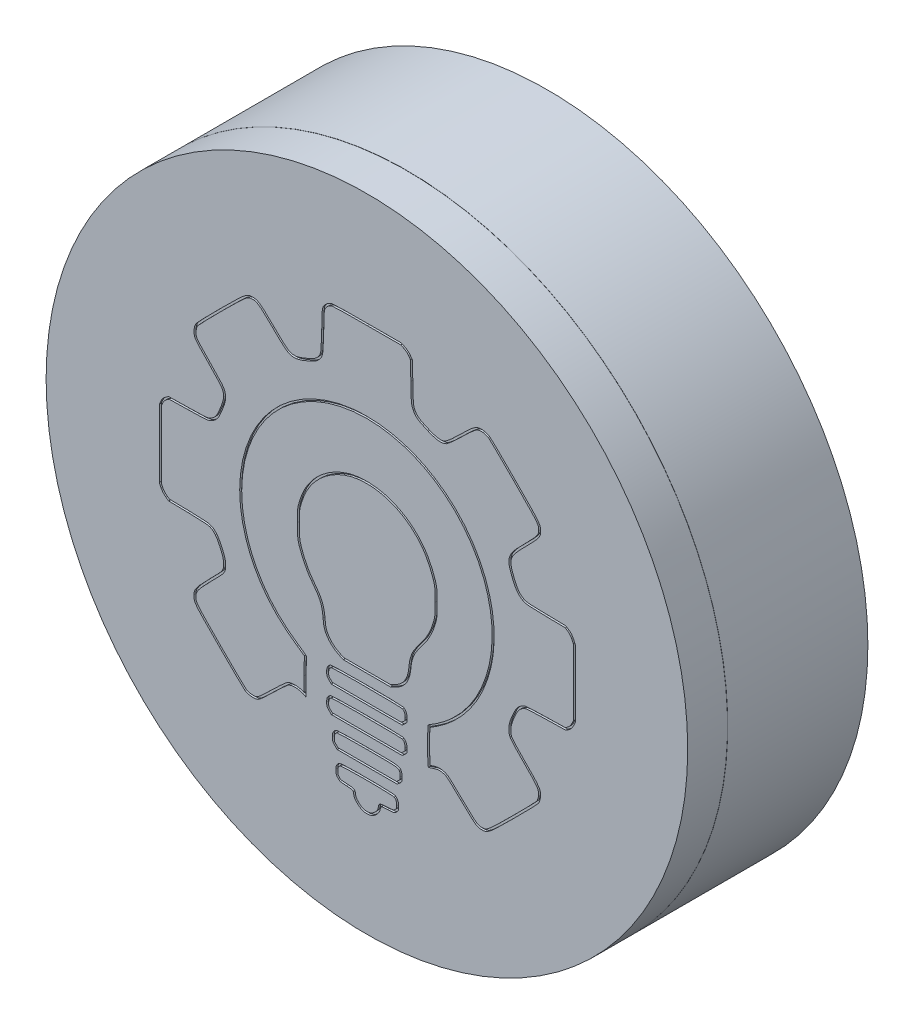
from build123d import *

# Parameters (mm, degrees)
SKETCH1_R           = 16.025
SKETCH1_R_2         = 15.025
BOSS_EXTRUDE1_DEPTH = 7
SKETCH2_R           = 16.025
BOSS_EXTRUDE3_DEPTH = 2
CUT_EXTRUDE1_DEPTH  = 0.1
SKETCH6_R           = 16.025
SKETCH6_R_2         = 16.015
CUT_EXTRUDE3_DEPTH  = 0.01


with BuildPart() as part:
    # Sketch1 → Boss-Extrude1 (new body)
    with BuildSketch(Plane.XY):
        Circle(SKETCH1_R)
        Circle(SKETCH1_R_2, mode=Mode.SUBTRACT)
    extrude(amount=BOSS_EXTRUDE1_DEPTH)

    # Sketch2 → Boss-Extrude3 (add)
    with BuildSketch(Plane.XY.offset(7)):
        Circle(SKETCH2_R)
    extrude(amount=BOSS_EXTRUDE3_DEPTH)

    # Sketch4 → Cut-Extrude1 (cut)
    # profile 1 of 6: a face of its own
    with BuildSketch(Plane.XY.offset(9)):
        with BuildLine():
            Line((-8.9288112, 2.310141401), (-9.9024785, 2.292502501))
            Line((-9.9024785, 2.292502501), (-10.0506452, 2.193724701))
            add(Edge.make_bspline(
                [(-10.0506452, 2.193724701), (-10.1529508, 2.123169101), (-10.2270342, 2.038502301), (-10.2870065, 1.911502301)],
                knots=[0, 0, 0, 0, 1, 1, 1, 1], degree=3))
            Line((-10.2870065, 1.911502301), (-10.3716732, 1.728057701))
            Line((-10.3716732, 1.728057701), (-10.3716732, 0.031195501))
            Line((-10.3716732, 0.031195501), (-10.3716732, -1.662138899))
            Line((-10.3716732, -1.662138899), (-10.2834787, -1.842055699))
            add(Edge.make_bspline(
                [(-10.2834787, -1.842055699), (-10.2270342, -1.954944599), (-10.1388397, -2.060777999), (-10.0471174, -2.120750299)],
                knots=[0, 0, 0, 0, 1, 1, 1, 1], degree=3))
            Line((-10.0471174, -2.120750299), (-9.9024785, -2.223055899))
            Line((-9.9024785, -2.223055899), (-8.9288112, -2.240694799))
            add(Edge.make_bspline(
                [(-8.9288112, -2.240694799), (-7.8281438, -2.261861499), (-7.792866, -2.268916999), (-7.5706159, -2.526444999)],
                knots=[0, 0, 0, 0, 1, 1, 1, 1], degree=3))
            add(Edge.make_bspline(
                [(-7.5706159, -2.526444999), (-7.4295047, -2.692250599), (-7.2107823, -3.172028699), (-7.1649212, -3.429556699)],
                knots=[0, 0, 0, 0, 1, 1, 1, 1], degree=3))
            add(Edge.make_bspline(
                [(-7.1649212, -3.429556699), (-7.1472823, -3.517751199), (-7.1508101, -3.651806799), (-7.168449, -3.750584599)],
                knots=[0, 0, 0, 0, 1, 1, 1, 1], degree=3))
            add(Edge.make_bspline(
                [(-7.168449, -3.750584599), (-7.2037268, -3.902279199), (-7.2566435, -3.969306999), (-7.8528383, -4.569029599)],
                knots=[0, 0, 0, 0, 1, 1, 1, 1], degree=3))
            add(Edge.make_bspline(
                [(-7.8528383, -4.569029599), (-8.5195887, -5.242835599), (-8.6395332, -5.412168999), (-8.643061, -5.659113599)],
                knots=[0, 0, 0, 0, 1, 1, 1, 1], degree=3))
            add(Edge.make_bspline(
                [(-8.643061, -5.659113599), (-8.643061, -5.980141599), (-8.6289499, -5.997780499), (-7.376588, -7.260725699)],
                knots=[0, 0, 0, 0, 1, 1, 1, 1], degree=3))
            add(Edge.make_bspline(
                [(-7.376588, -7.260725699), (-6.7239487, -7.916892799), (-6.141865, -8.484865399), (-6.0783649, -8.523670999)],
                knots=[0, 0, 0, 0, 1, 1, 1, 1], degree=3))
            add(Edge.make_bspline(
                [(-6.0783649, -8.523670999), (-5.9301982, -8.615393299), (-5.6550313, -8.647143299), (-5.4821701, -8.590698799)],
                knots=[0, 0, 0, 0, 1, 1, 1, 1], degree=3))
            add(Edge.make_bspline(
                [(-5.4821701, -8.590698799), (-5.3798645, -8.558948799), (-5.178781, -8.382559799), (-4.6919474, -7.902781699)],
                knots=[0, 0, 0, 0, 1, 1, 1, 1], degree=3))
            add(Edge.make_bspline(
                [(-4.6919474, -7.902781699), (-4.3321138, -7.550003699), (-3.9828636, -7.228975699), (-3.9158358, -7.193697899)],
                knots=[0, 0, 0, 0, 1, 1, 1, 1], degree=3))
            add(Edge.make_bspline(
                [(-3.9158358, -7.193697899), (-3.7429746, -7.101975599), (-3.414891, -7.109031199), (-3.1996965, -7.204281299)],
                knots=[0, 0, 0, 0, 1, 1, 1, 1], degree=3))
            Line((-3.1996965, -7.204281299), (-3.0338908, -7.281892399))
            Line((-3.0338908, -7.281892399), (-3.0338908, -6.399947399))
            add(Edge.make_bspline(
                [(-3.0338908, -6.399947399), (-3.0338908, -5.916641599), (-3.030363, -5.510946899), (-3.0268352, -5.493307999)],
                knots=[0, 0, 0, 0, 1, 1, 1, 1], degree=3))
            add(Edge.make_bspline(
                [(-3.0268352, -5.493307999), (-3.0268352, -5.479196799), (-3.206752, -5.345141199), (-3.4325299, -5.193446699)],
                knots=[0, 0, 0, 0, 1, 1, 1, 1], degree=3))
            add(Edge.make_bspline(
                [(-3.4325299, -5.193446699), (-4.6566696, -4.375001699), (-5.4892257, -3.288445499), (-5.9407815, -1.919666799)],
                knots=[0, 0, 0, 0, 1, 1, 1, 1], degree=3))
            add(Edge.make_bspline(
                [(-5.9407815, -1.919666799), (-6.7803932, 0.609751401), (-5.8984482, 3.431975401), (-3.7711968, 5.033587601)],
                knots=[0, 0, 0, 0, 1, 1, 1, 1], degree=3))
            add(Edge.make_bspline(
                [(-3.7711968, 5.033587601), (-1.6898066, 6.596394101), (1.1183063, 6.716338601), (3.3337521, 5.333448901)],
                knots=[0, 0, 0, 0, 1, 1, 1, 1], degree=3))
            add(Edge.make_bspline(
                [(3.3337521, 5.333448901), (5.7502814, 3.827086801), (6.8403654, 0.810834901), (5.9443093, -1.905555699)],
                knots=[0, 0, 0, 0, 1, 1, 1, 1], degree=3))
            add(Edge.make_bspline(
                [(5.9443093, -1.905555699), (5.5033368, -3.253167699), (4.649614, -4.378529499), (3.4713355, -5.168752199)],
                knots=[0, 0, 0, 0, 1, 1, 1, 1], degree=3))
            add(Edge.make_bspline(
                [(3.4713355, -5.168752199), (3.2737798, -5.299280099), (3.0973908, -5.412168999), (3.0726964, -5.419224599)],
                knots=[0, 0, 0, 0, 1, 1, 1, 1], degree=3))
            add(Edge.make_bspline(
                [(3.0726964, -5.419224599), (3.0091963, -5.440391299), (3.0127241, -7.271309099), (3.0762242, -7.260725699)],
                knots=[0, 0, 0, 0, 1, 1, 1, 1], degree=3))
            add(Edge.make_bspline(
                [(3.0762242, -7.260725699), (3.1009186, -7.257197999), (3.2173354, -7.218392399), (3.3337521, -7.179586799)],
                knots=[0, 0, 0, 0, 1, 1, 1, 1], degree=3))
            add(Edge.make_bspline(
                [(3.3337521, -7.179586799), (3.5630578, -7.094920099), (3.7711968, -7.105503399), (3.9687525, -7.204281299)],
                knots=[0, 0, 0, 0, 1, 1, 1, 1], degree=3))
            add(Edge.make_bspline(
                [(3.9687525, -7.204281299), (4.025197, -7.236031299), (4.3603361, -7.542948099), (4.7095863, -7.888670599)],
                knots=[0, 0, 0, 0, 1, 1, 1, 1], degree=3))
            add(Edge.make_bspline(
                [(4.7095863, -7.888670599), (5.3516423, -8.523670999), (5.4927535, -8.625976599), (5.7185314, -8.625976599)],
                knots=[0, 0, 0, 0, 1, 1, 1, 1], degree=3))
            add(Edge.make_bspline(
                [(5.7185314, -8.625976599), (6.0325038, -8.625976599), (6.0571983, -8.608337699), (7.3130879, -7.359503599)],
                knots=[0, 0, 0, 0, 1, 1, 1, 1], degree=3))
            add(Edge.make_bspline(
                [(7.3130879, -7.359503599), (7.969255, -6.706864299), (8.5372276, -6.124780599), (8.5760332, -6.061280499)],
                knots=[0, 0, 0, 0, 1, 1, 1, 1], degree=3))
            add(Edge.make_bspline(
                [(8.5760332, -6.061280499), (8.6148388, -6.001308299), (8.6536443, -5.870780399), (8.6677555, -5.772002599)],
                knots=[0, 0, 0, 0, 1, 1, 1, 1], degree=3))
            add(Edge.make_bspline(
                [(8.6677555, -5.772002599), (8.706561, -5.443918999), (8.6360054, -5.338085599), (7.9269217, -4.625474099)],
                knots=[0, 0, 0, 0, 1, 1, 1, 1], degree=3))
            add(Edge.make_bspline(
                [(7.9269217, -4.625474099), (7.552977, -4.251529399), (7.2707546, -3.937556999), (7.2390046, -3.867001399)],
                knots=[0, 0, 0, 0, 1, 1, 1, 1], degree=3))
            add(Edge.make_bspline(
                [(7.2390046, -3.867001399), (7.1472823, -3.648278999), (7.1719767, -3.422501099), (7.3201435, -3.052084199)],
                knots=[0, 0, 0, 0, 1, 1, 1, 1], degree=3))
            add(Edge.make_bspline(
                [(7.3201435, -3.052084199), (7.5176992, -2.565250599), (7.6235326, -2.427667099), (7.9022272, -2.304194799)],
                knots=[0, 0, 0, 0, 1, 1, 1, 1], degree=3))
            add(Edge.make_bspline(
                [(7.9022272, -2.304194799), (7.9551439, -2.279500399), (8.3643664, -2.254805899), (8.964089, -2.244222599)],
                knots=[0, 0, 0, 0, 1, 1, 1, 1], degree=3))
            Line((8.964089, -2.244222599), (9.9377563, -2.223055899))
            Line((9.9377563, -2.223055899), (10.0788675, -2.127805799))
            add(Edge.make_bspline(
                [(10.0788675, -2.127805799), (10.1705897, -2.067833599), (10.2552565, -1.969055699), (10.3152287, -1.849111199)],
                knots=[0, 0, 0, 0, 1, 1, 1, 1], degree=3))
            Line((10.3152287, -1.849111199), (10.406951, -1.662138899))
            Line((10.406951, -1.662138899), (10.406951, 0.031195501))
            Line((10.406951, 0.031195501), (10.406951, 1.728057701))
            Line((10.406951, 1.728057701), (10.3222843, 1.911502301))
            add(Edge.make_bspline(
                [(10.3222843, 1.911502301), (10.262312, 2.038502301), (10.1882286, 2.123169101), (10.085923, 2.193724701)],
                knots=[0, 0, 0, 0, 1, 1, 1, 1], degree=3))
            Line((10.085923, 2.193724701), (9.9377563, 2.292502501))
            Line((9.9377563, 2.292502501), (8.964089, 2.310141401))
            add(Edge.make_bspline(
                [(8.964089, 2.310141401), (8.0468662, 2.327780301), (7.9833661, 2.334835901), (7.8422549, 2.405391501)],
                knots=[0, 0, 0, 0, 1, 1, 1, 1], degree=3))
            add(Edge.make_bspline(
                [(7.8422549, 2.405391501), (7.6305881, 2.518280401), (7.5071158, 2.691141601), (7.3413102, 3.103891901)],
                knots=[0, 0, 0, 0, 1, 1, 1, 1], degree=3))
            add(Edge.make_bspline(
                [(7.3413102, 3.103891901), (7.0696711, 3.788281201), (7.1155323, 3.915281301), (7.9551439, 4.744309601)],
                knots=[0, 0, 0, 0, 1, 1, 1, 1], degree=3))
            add(Edge.make_bspline(
                [(7.9551439, 4.744309601), (8.5583943, 5.340504401), (8.674811, 5.499254501), (8.6783388, 5.728560201)],
                knots=[0, 0, 0, 0, 1, 1, 1, 1], degree=3))
            add(Edge.make_bspline(
                [(8.6783388, 5.728560201), (8.6783388, 6.049588201), (8.6642277, 6.067227101), (7.4118658, 7.330172301)],
                knots=[0, 0, 0, 0, 1, 1, 1, 1], degree=3))
            add(Edge.make_bspline(
                [(7.4118658, 7.330172301), (6.7592265, 7.986339401), (6.1771428, 8.554312001), (6.1136427, 8.593117601)],
                knots=[0, 0, 0, 0, 1, 1, 1, 1], degree=3))
            add(Edge.make_bspline(
                [(6.1136427, 8.593117601), (6.0536705, 8.631923201), (5.9231426, 8.670728701), (5.8243648, 8.684839901)],
                knots=[0, 0, 0, 0, 1, 1, 1, 1], degree=3))
            add(Edge.make_bspline(
                [(5.8243648, 8.684839901), (5.4962812, 8.723645401), (5.3833923, 8.653089801), (4.6743085, 7.951061601)],
                knots=[0, 0, 0, 0, 1, 1, 1, 1], degree=3))
            add(Edge.make_bspline(
                [(4.6743085, 7.951061601), (4.2862527, 7.570061401), (3.9863914, 7.301950101), (3.9052525, 7.266672301)],
                knots=[0, 0, 0, 0, 1, 1, 1, 1], degree=3))
            add(Edge.make_bspline(
                [(3.9052525, 7.266672301), (3.6900579, 7.178477801), (3.5101411, 7.199644501), (3.0903353, 7.372505701)],
                knots=[0, 0, 0, 0, 1, 1, 1, 1], degree=3))
            add(Edge.make_bspline(
                [(3.0903353, 7.372505701), (2.6281961, 7.563005801), (2.501196, 7.651200301), (2.3953626, 7.873450501)],
                knots=[0, 0, 0, 0, 1, 1, 1, 1], degree=3))
            add(Edge.make_bspline(
                [(2.3953626, 7.873450501), (2.3142237, 8.035728301), (2.3106959, 8.085117301), (2.293057, 8.998812301)],
                knots=[0, 0, 0, 0, 1, 1, 1, 1], degree=3))
            Line((2.293057, 8.998812301), (2.2754181, 9.954840701))
            Line((2.2754181, 9.954840701), (2.180168, 10.095951901))
            add(Edge.make_bspline(
                [(2.180168, 10.095951901), (2.1201958, 10.187674101), (2.0214179, 10.272340901), (1.9014734, 10.332313101)],
                knots=[0, 0, 0, 0, 1, 1, 1, 1], degree=3))
            Line((1.9014734, 10.332313101), (1.7145011, 10.424035401))
            Line((1.7145011, 10.424035401), (0.0211667, 10.420507601))
            add(Edge.make_bspline(
                [(0.0211667, 10.420507601), (-1.0830285, 10.420507601), (-1.7145011, 10.406396501), (-1.7815289, 10.381702001)],
                knots=[0, 0, 0, 0, 1, 1, 1, 1], degree=3))
            add(Edge.make_bspline(
                [(-1.7815289, 10.381702001), (-1.9438068, 10.321729801), (-2.0672791, 10.222951901), (-2.1590014, 10.078313001)],
                knots=[0, 0, 0, 0, 1, 1, 1, 1], degree=3))
            add(Edge.make_bspline(
                [(-2.1590014, 10.078313001), (-2.2366125, 9.951312901), (-2.2401403, 9.912507301), (-2.2577792, 8.995284501)],
                knots=[0, 0, 0, 0, 1, 1, 1, 1], degree=3))
            add(Edge.make_bspline(
                [(-2.2577792, 8.995284501), (-2.2789459, 7.944006101), (-2.2895292, 7.891089401), (-2.5117794, 7.668839201)],
                knots=[0, 0, 0, 0, 1, 1, 1, 1], degree=3))
            add(Edge.make_bspline(
                [(-2.5117794, 7.668839201), (-2.6564183, 7.520672501), (-3.287891, 7.249033401), (-3.5383633, 7.220811201)],
                knots=[0, 0, 0, 0, 1, 1, 1, 1], degree=3))
            add(Edge.make_bspline(
                [(-3.5383633, 7.220811201), (-3.848808, 7.189061101), (-3.9581692, 7.263144501), (-4.6425585, 7.944006101)],
                knots=[0, 0, 0, 0, 1, 1, 1, 1], degree=3))
            add(Edge.make_bspline(
                [(-4.6425585, 7.944006101), (-5.2810867, 8.579006501), (-5.4398368, 8.691895401), (-5.6797258, 8.695423201)],
                knots=[0, 0, 0, 0, 1, 1, 1, 1], degree=3))
            add(Edge.make_bspline(
                [(-5.6797258, 8.695423201), (-6.0042816, 8.695423201), (-6.0148649, 8.688367601), (-7.2778101, 7.432478001)],
                knots=[0, 0, 0, 0, 1, 1, 1, 1], degree=3))
            add(Edge.make_bspline(
                [(-7.2778101, 7.432478001), (-7.9339772, 6.776310901), (-8.5019498, 6.194227201), (-8.5407554, 6.130727101)],
                knots=[0, 0, 0, 0, 1, 1, 1, 1], degree=3))
            add(Edge.make_bspline(
                [(-8.5407554, 6.130727101), (-8.6324777, 5.982560401), (-8.6642277, 5.707393501), (-8.6077832, 5.534532301)],
                knots=[0, 0, 0, 0, 1, 1, 1, 1], degree=3))
            add(Edge.make_bspline(
                [(-8.6077832, 5.534532301), (-8.5725054, 5.432226701), (-8.3925886, 5.224087701), (-7.8986994, 4.723142901)],
                knots=[0, 0, 0, 0, 1, 1, 1, 1], degree=3))
            add(Edge.make_bspline(
                [(-7.8986994, 4.723142901), (-7.1966712, 4.010531401), (-7.1613934, 3.957614701), (-7.1613934, 3.626003301)],
                knots=[0, 0, 0, 0, 1, 1, 1, 1], degree=3))
            add(Edge.make_bspline(
                [(-7.1613934, 3.626003301), (-7.1613934, 3.435503201), (-7.4189213, 2.782863901), (-7.5565048, 2.610002701)],
                knots=[0, 0, 0, 0, 1, 1, 1, 1], degree=3))
            add(Edge.make_bspline(
                [(-7.5565048, 2.610002701), (-7.616477, 2.542974901), (-7.729366, 2.447724801), (-7.8069771, 2.405391501)],
                knots=[0, 0, 0, 0, 1, 1, 1, 1], degree=3))
            add(Edge.make_bspline(
                [(-7.8069771, 2.405391501), (-7.9480883, 2.334835901), (-8.0115884, 2.327780301), (-8.9288112, 2.310141401)],
                knots=[0, 0, 0, 0, 1, 1, 1, 1], degree=3))
        make_face()
        with BuildLine():
            Line((-8.926999902, 2.210157744), (-9.871380494, 2.193049462))
            Line((-9.871380494, 2.193049462), (-9.994499236, 2.110970301))
            add(Edge.make_bspline(
                [(-9.994499236, 2.110970301), (-10.015972402, 2.096128416), (-10.058129542, 2.063359706), (-10.109608985, 2.010305558), (-10.154972216, 1.948920007), (-10.184115388, 1.895200747), (-10.196581657, 1.868801625)],
                knots=[0.002322855, 0.002322855, 0.002322855, 0.002322855, 0.251742141, 0.501161428, 0.750580714, 1, 1, 1, 1], degree=3))
            Line((-10.196581657, 1.868801625), (-10.2716732, 1.706094025))
            Line((-10.2716732, 1.706094025), (-10.2716732, 0.031195501))
            Line((-10.2716732, 0.031195501), (-10.2716732, -1.638947353))
            Line((-10.2716732, -1.638947353), (-10.194035997, -1.797334308))
            add(Edge.make_bspline(
                [(-10.194035997, -1.797334308), (-10.18150014, -1.822406), (-10.153346231, -1.870863391), (-10.102472256, -1.939044575), (-10.045879437, -1.997625998), (-10.010525725, -2.02519697), (-9.990862899, -2.038053438)],
                knots=[0, 0, 0, 0, 0.251389654, 0.502779308, 0.754168962, 1.005558616, 1.005558616, 1.005558616, 1.005558616], degree=3))
            Line((-9.990862899, -2.038053438), (-9.869875205, -2.123630131))
            Line((-9.869875205, -2.123630131), (-8.926999941, -2.140711142))
            add(Edge.make_bspline(
                [(-8.926999941, -2.140711142), (-8.862180746, -2.141957666), (-8.726909995, -2.144608165), (-8.501448284, -2.149717566), (-8.267017407, -2.157315144), (-8.055495061, -2.171596562), (-7.840447676, -2.202019618), (-7.652009029, -2.280468647), (-7.546256444, -2.40161365), (-7.494685221, -2.461370806)],
                knots=[-3.3757e-05, -3.3757e-05, -3.3757e-05, -3.3757e-05, 0.062489449, 0.125012655, 0.250059066, 0.375105477, 0.500151889, 0.750244711, 1.000337534, 1.000337534, 1.000337534, 1.000337534], degree=3))
            add(Edge.make_bspline(
                [(-7.494685221, -2.461370806), (-7.471782984, -2.488280924), (-7.432614325, -2.542212679), (-7.345707626, -2.684567473), (-7.238650158, -2.897169549), (-7.126186895, -3.178571763), (-7.081413169, -3.328672852), (-7.066651646, -3.411008399)],
                knots=[-0.000527359, -0.000527359, -0.000527359, -0.000527359, 0.124392901, 0.249313161, 0.499153681, 0.748994201, 0.998834721, 0.998834721, 0.998834721, 0.998834721], degree=3))
            add(Edge.make_bspline(
                [(-7.066651646, -3.411008399), (-7.061005167, -3.439556125), (-7.05438461, -3.496209784), (-7.052257588, -3.589646962), (-7.057609528, -3.684324327), (-7.065267769, -3.741628224), (-7.070461535, -3.770713298)],
                knots=[0.003225677, 0.003225677, 0.003225677, 0.003225677, 0.254570237, 0.505914798, 0.757259358, 1.008603918, 1.008603918, 1.008603918, 1.008603918], degree=3))
            add(Edge.make_bspline(
                [(-7.070461535, -3.770713298), (-7.080965153, -3.815878874), (-7.106104641, -3.898585742), (-7.189632632, -4.018930581), (-7.302911509, -4.1476857), (-7.419174728, -4.271182276), (-7.548703064, -4.403992639), (-7.672683008, -4.52953956), (-7.746399011, -4.603800796), (-7.781837728, -4.639449286)],
                knots=[-0.005543247, -0.005543247, -0.005543247, -0.005543247, 0.245831167, 0.497205581, 0.622892788, 0.748579995, 0.874267202, 0.937110805, 0.999954408, 0.999954408, 0.999954408, 0.999954408], degree=3))
            add(Edge.make_bspline(
                [(-7.781837728, -4.639449286), (-7.821337599, -4.679367379), (-7.903003322, -4.762272485), (-8.04261815, -4.905889187), (-8.190355549, -5.062214834), (-8.3242641, -5.213606398), (-8.453098972, -5.377541834), (-8.529965401, -5.518028757), (-8.542300438, -5.610169362), (-8.543060974, -5.659850768)],
                knots=[4.0741e-05, 4.0741e-05, 4.0741e-05, 4.0741e-05, 0.062471231, 0.124901721, 0.249762701, 0.374623681, 0.499484661, 0.74920662, 0.99892858, 0.99892858, 0.99892858, 0.99892858], degree=3))
            add(Edge.make_bspline(
                [(-8.543060974, -5.659850768), (-8.543058616, -5.693372824), (-8.542206954, -5.767766431), (-8.529618183, -5.835035996), (-8.493945196, -5.917625312), (-8.411132744, -6.036708128), (-8.2655905, -6.206190372), (-8.045548764, -6.439835629), (-7.786403657, -6.704628735), (-7.532702631, -6.961244907), (-7.37911461, -7.116157566), (-7.305633679, -7.190259466)],
                knots=[0.000773296, 0.000773296, 0.000773296, 0.000773296, 0.125674862, 0.250576429, 0.375477995, 0.500379561, 0.625281128, 0.750182694, 0.87508426, 0.937535043, 0.999985827, 0.999985827, 0.999985827, 0.999985827], degree=3))
            add(Edge.make_bspline(
                [(-7.305633679, -7.190259466), (-7.153358611, -7.343357428), (-6.833346307, -7.66304909), (-6.503294922, -7.98785416), (-6.287950314, -8.196541318), (-6.157452131, -8.320750542), (-6.080359922, -8.392111839), (-6.036993208, -8.429696395), (-6.030525658, -8.435099243), (-6.025067512, -8.439053011)],
                knots=[2.7251e-05, 2.7251e-05, 2.7251e-05, 2.7251e-05, 0.244110931, 0.488194611, 0.610236451, 0.732278291, 0.854320131, 0.915341051, 0.976361971, 0.976361971, 0.976361971, 0.976361971], degree=3))
            add(Edge.make_bspline(
                [(-6.025067512, -8.439053011), (-5.991683575, -8.459594711), (-5.924688121, -8.487023434), (-5.777987246, -8.518332878), (-5.627062216, -8.520611861), (-5.551398416, -8.508107856), (-5.512511789, -8.495410175)],
                knots=[0.002002929, 0.002002929, 0.002002929, 0.002002929, 0.251838933, 0.501674936, 0.75151094, 1.001346943, 1.001346943, 1.001346943, 1.001346943], degree=3))
            add(Edge.make_bspline(
                [(-5.512511789, -8.495410175), (-5.503630428, -8.492653892), (-5.49204372, -8.487619639), (-5.428649131, -8.449277602), (-5.311258827, -8.355216002), (-5.126465278, -8.185462959), (-4.937693821, -8.003880128), (-4.818337078, -7.886939346), (-4.762047425, -7.831465478)],
                knots=[-0.002286545, -0.002286545, -0.002286545, -0.002286545, 0.123007203, 0.248300951, 0.498888447, 0.749475942, 0.87476969, 1.000063438, 1.000063438, 1.000063438, 1.000063438], degree=3))
            add(Edge.make_bspline(
                [(-4.762047425, -7.831465478), (-4.674457025, -7.745592547), (-4.491274922, -7.568656822), (-4.253074706, -7.346142939), (-4.098187271, -7.207928456), (-4.011645422, -7.137525983), (-3.981196982, -7.115120833), (-3.962582295, -7.10529665)],
                knots=[-8.6047e-05, -8.6047e-05, -8.6047e-05, -8.6047e-05, 0.249846695, 0.499779438, 0.749712181, 0.874678553, 0.999644924, 0.999644924, 0.999644924, 0.999644924], degree=3))
            add(Edge.make_bspline(
                [(-3.962582295, -7.10529665), (-3.905649892, -7.075110111), (-3.783711985, -7.038283863), (-3.572289683, -7.022363401), (-3.354529846, -7.045671956), (-3.221872837, -7.085107619), (-3.158257536, -7.113265234)],
                knots=[0.000188654, 0.000188654, 0.000188654, 0.000188654, 0.250514884, 0.500841113, 0.751167343, 1.001493572, 1.001493572, 1.001493572, 1.001493572], degree=3))
            Line((-3.158257536, -7.113265234), (-3.1338908, -7.124670929))
            Line((-3.1338908, -7.124670929), (-3.1338908, -6.399947399))
            add(Edge.make_bspline(
                [(-3.1338908, -6.399947399), (-3.1338908, -6.304236749), (-3.133591496, -6.104893166), (-3.132412713, -5.853413341), (-3.131022816, -5.686465295), (-3.129655456, -5.584486603), (-3.129069249, -5.552127339), (-3.128626826, -5.533621886)],
                knots=[0, 0, 0, 0, 0.206566596, 0.413133192, 0.619699788, 0.722983086, 0.826266384, 0.826266384, 0.826266384, 0.826266384], degree=3))
            add(Edge.make_bspline(
                [(-3.128626826, -5.533621886), (-3.147794136, -5.518036027), (-3.181037784, -5.492491351), (-3.267984486, -5.428646206), (-3.369180851, -5.357359427), (-3.449407195, -5.302582623), (-3.488205268, -5.27651454)],
                knots=[0.277509677, 0.277509677, 0.277509677, 0.277509677, 0.458097373, 0.638685068, 0.819272763, 0.999860458, 0.999860458, 0.999860458, 0.999860458], degree=3))
            add(Edge.make_bspline(
                [(-3.488205268, -5.27651454), (-3.790377758, -5.074479003), (-4.373472623, -4.61768117), (-5.079590788, -3.841014661), (-5.642722086, -2.960719832), (-5.923656624, -2.290755599), (-6.035718464, -1.951083056)],
                knots=[2.5476e-05, 2.5476e-05, 2.5476e-05, 2.5476e-05, 0.250013865, 0.500002254, 0.749990643, 0.999979032, 0.999979032, 0.999979032, 0.999979032], degree=3))
            add(Edge.make_bspline(
                [(-6.035718464, -1.951083056), (-6.141114012, -1.63355234), (-6.301568888, -0.976155378), (-6.406742596, 0.338049877), (-6.158565084, 1.96433807), (-5.437548547, 3.442728464), (-4.603842801, 4.463346741), (-4.098379694, 4.912425234), (-3.831292648, 5.113515652)],
                knots=[1.133e-05, 1.133e-05, 1.133e-05, 1.133e-05, 0.125010941, 0.250010551, 0.500009773, 0.750008995, 0.875008605, 1.000008216, 1.000008216, 1.000008216, 1.000008216], degree=3))
            add(Edge.make_bspline(
                [(-3.831292648, 5.113515652), (-3.570453606, 5.309365978), (-3.013866092, 5.664186454), (-1.841426533, 6.180421468), (-0.277544967, 6.482033843), (1.307709023, 6.313791097), (2.522389493, 5.898355393), (3.109162864, 5.591519146), (3.386677585, 5.418295196)],
                knots=[-8.405e-06, -8.405e-06, -8.405e-06, -8.405e-06, 0.124992167, 0.249992739, 0.499993884, 0.749995028, 0.874995601, 0.999996173, 0.999996173, 0.999996173, 0.999996173], degree=3))
            add(Edge.make_bspline(
                [(3.386677585, 5.418295196), (3.689537216, 5.229503264), (4.267420724, 4.795067968), (5.229099114, 3.772454906), (6.080963031, 2.240281635), (6.404506838, 0.515150429), (6.318402249, -0.889961918), (6.151543921, -1.596520369), (6.039313235, -1.936768941)],
                knots=[3.509e-06, 3.509e-06, 3.509e-06, 3.509e-06, 0.125001358, 0.249999208, 0.499994908, 0.749990608, 0.874988458, 0.999986308, 0.999986308, 0.999986308, 0.999986308], degree=3))
            add(Edge.make_bspline(
                [(6.039313235, -1.936768941), (5.928816048, -2.274427809), (5.650457274, -2.937051287), (5.086979503, -3.824246415), (4.384820383, -4.606557464), (3.821946552, -5.054018793), (3.526748694, -5.251995797)],
                knots=[2.7633e-05, 2.7633e-05, 2.7633e-05, 2.7633e-05, 0.250040962, 0.500054291, 0.75006762, 1.00008095, 1.00008095, 1.00008095, 1.00008095], degree=3))
            add(Edge.make_bspline(
                [(3.526748694, -5.251995797), (3.488383836, -5.277344013), (3.408869381, -5.329576632), (3.305059726, -5.396816361), (3.2142094, -5.454124321), (3.17678663, -5.476932261), (3.154763423, -5.489547854)],
                knots=[-0.000485027, -0.000485027, -0.000485027, -0.000485027, 0.199236321, 0.39895767, 0.598679018, 0.798400367, 0.798400367, 0.798400367, 0.798400367], degree=3))
            add(Edge.make_bspline(
                [(3.154763423, -5.489547854), (3.152242452, -5.506750568), (3.148932279, -5.53662281), (3.141166481, -5.634296239), (3.134010227, -5.790033643), (3.128458228, -6.019776912), (3.126297176, -6.271745262), (3.127401209, -6.528469356), (3.131803734, -6.772368853), (3.138023184, -6.948341982), (3.144787226, -7.066911196), (3.148157662, -7.110955695), (3.150388122, -7.134836326)],
                knots=[0.098871727, 0.098871727, 0.098871727, 0.098871727, 0.145400216, 0.191928704, 0.284985681, 0.378042658, 0.471099635, 0.564156612, 0.657213589, 0.750270566, 0.796799054, 0.843327543, 0.843327543, 0.843327543, 0.843327543], degree=3))
            add(Edge.make_bspline(
                [(3.150388122, -7.134836326), (3.161865191, -7.131130324), (3.184084019, -7.123887792), (3.221658781, -7.111497281), (3.260573651, -7.098569601), (3.287360116, -7.089641533), (3.300646765, -7.085212656)],
                knots=[0.53687387, 0.53687387, 0.53687387, 0.53687387, 0.651594126, 0.766314383, 0.88103464, 0.995754896, 0.995754896, 0.995754896, 0.995754896], degree=3))
            add(Edge.make_bspline(
                [(3.300646765, -7.085212656), (3.360998873, -7.063022753), (3.488502442, -7.028087087), (3.670096116, -7.016906693), (3.84749467, -7.044196716), (3.96160335, -7.088903312), (4.015654083, -7.115928693)],
                knots=[0.002040543, 0.002040543, 0.002040543, 0.002040543, 0.252450065, 0.502859588, 0.753269111, 1.003678634, 1.003678634, 1.003678634, 1.003678634], degree=3))
            add(Edge.make_bspline(
                [(4.015654083, -7.115928693), (4.031419609, -7.124796792), (4.056636489, -7.143240802), (4.136015346, -7.208927272), (4.282915591, -7.340754834), (4.513898989, -7.557432241), (4.694163701, -7.73269503), (4.779921165, -7.817586091)],
                knots=[-0.012546272, -0.012546272, -0.012546272, -0.012546272, 0.114020115, 0.240586502, 0.493719276, 0.74685205, 0.999984824, 0.999984824, 0.999984824, 0.999984824], degree=3))
            add(Edge.make_bspline(
                [(4.779921165, -7.817586091), (4.8179526, -7.85519956), (4.897000051, -7.933087247), (5.033102003, -8.065668029), (5.180195467, -8.205344878), (5.320827715, -8.330798762), (5.471039376, -8.449920884), (5.593469652, -8.516990739), (5.674951397, -8.525976599), (5.7185314, -8.525976599)],
                knots=[8.288e-06, 8.288e-06, 8.288e-06, 8.288e-06, 0.06250777, 0.125007252, 0.250006216, 0.37500518, 0.500004144, 0.750002072, 1, 1, 1, 1], degree=3))
            add(Edge.make_bspline(
                [(5.7185314, -8.525976599), (5.751337275, -8.525976599), (5.824037622, -8.5250464), (5.890315546, -8.512362873), (5.9728663, -8.476337166), (6.09207196, -8.393123137), (6.261570955, -8.247374945), (6.494927106, -8.027362034), (6.758983798, -7.76850994), (7.014623973, -7.515211986), (7.16881259, -7.361943712), (7.242572378, -7.288598302)],
                knots=[0, 0, 0, 0, 0.124999857, 0.249999714, 0.374999571, 0.499999428, 0.624999286, 0.749999143, 0.874999, 0.937498928, 0.999998857, 0.999998857, 0.999998857, 0.999998857], degree=3))
            add(Edge.make_bspline(
                [(7.242572378, -7.288598302), (7.395583599, -7.136409709), (7.715079676, -6.816594784), (8.039759547, -6.486676743), (8.24843514, -6.271352143), (8.372689822, -6.140817897), (8.444152836, -6.063626181), (8.481846416, -6.020164602), (8.487369235, -6.013552245), (8.491377405, -6.008035225)],
                knots=[2.189e-06, 2.189e-06, 2.189e-06, 2.189e-06, 0.243935921, 0.487869654, 0.60983652, 0.731803386, 0.853770253, 0.914753686, 0.975737119, 0.975737119, 0.975737119, 0.975737119], degree=3))
            add(Edge.make_bspline(
                [(8.491377405, -6.008035225), (8.499654697, -5.995243066), (8.510410303, -5.973277788), (8.53612486, -5.90413706), (8.556275893, -5.82817505), (8.565170163, -5.782684144), (8.568593327, -5.759027906)],
                knots=[-0.006009844, -0.006009844, -0.006009844, -0.006009844, 0.244357075, 0.494723995, 0.745090914, 0.995457833, 0.995457833, 0.995457833, 0.995457833], degree=3))
            add(Edge.make_bspline(
                [(8.568593327, -5.759027906), (8.572622929, -5.724765193), (8.578781696, -5.650184188), (8.570154894, -5.546017237), (8.528894726, -5.440616005), (8.412465779, -5.282729395), (8.281626003, -5.133128474), (8.130536194, -4.974346642), (7.984725843, -4.825610123), (7.897912178, -4.738091816), (7.856123969, -4.696095535)],
                knots=[0.001314798, 0.001314798, 0.001314798, 0.001314798, 0.126145306, 0.250975815, 0.500636831, 0.62546734, 0.750297848, 0.875128356, 0.93754361, 0.999958864, 0.999958864, 0.999958864, 0.999958864], degree=3))
            add(Edge.make_bspline(
                [(7.856123969, -4.696095535), (7.767301622, -4.607272012), (7.581499598, -4.417203194), (7.368813319, -4.189738437), (7.213713223, -4.007406493), (7.166662948, -3.949924687), (7.147284399, -3.906861218)],
                knots=[7.7923e-05, 7.7923e-05, 7.7923e-05, 7.7923e-05, 0.251446555, 0.502815186, 0.754183817, 1.005552449, 1.005552449, 1.005552449, 1.005552449], degree=3))
            add(Edge.make_bspline(
                [(7.147284399, -3.906861218), (7.121555618, -3.845507971), (7.084334895, -3.717358761), (7.082370374, -3.509231761), (7.12653937, -3.287732914), (7.192882296, -3.100979662), (7.22738928, -3.014712227)],
                knots=[-0.001811289, -0.001811289, -0.001811289, -0.001811289, 0.248693623, 0.499198534, 0.749703446, 1.000208358, 1.000208358, 1.000208358, 1.000208358], degree=3))
            add(Edge.make_bspline(
                [(7.22738928, -3.014712227), (7.250455933, -2.957869413), (7.300466503, -2.838499521), (7.387519065, -2.652698132), (7.49742037, -2.469751101), (7.654041328, -2.316774854), (7.79174434, -2.243798702), (7.861107562, -2.213036802)],
                knots=[-0.000158215, -0.000158215, -0.000158215, -0.000158215, 0.124774888, 0.24970799, 0.499574195, 0.7494404, 0.999306605, 0.999306605, 0.999306605, 0.999306605], degree=3))
            add(Edge.make_bspline(
                [(7.861107562, -2.213036802), (7.902929057, -2.194003088), (7.976252606, -2.188371322), (8.206825695, -2.167905757), (8.481273236, -2.156460687), (8.741343494, -2.14866856), (8.889933138, -2.145515267), (8.961916414, -2.144244028)],
                knots=[0.001884785, 0.001884785, 0.001884785, 0.001884785, 0.251356938, 0.50082909, 0.750301242, 0.875037318, 0.999773395, 0.999773395, 0.999773395, 0.999773395], degree=3))
            Line((8.961916414, -2.144244028), (9.906183732, -2.123717293))
            Line((9.906183732, -2.123717293), (10.023529234, -2.044509045))
            add(Edge.make_bspline(
                [(10.023529234, -2.044509045), (10.043031357, -2.031757659), (10.078620215, -2.004257704), (10.133384191, -1.948128839), (10.18312424, -1.881829864), (10.212777031, -1.830408064), (10.225786796, -1.804388511)],
                knots=[-0.002231974, -0.002231974, -0.002231974, -0.002231974, 0.248326019, 0.498884013, 0.749442006, 1, 1, 1, 1], degree=3))
            Line((10.225786796, -1.804388511), (10.30695183, -1.638930268))
            Line((10.30695183, -1.638930268), (10.30695183, 0.03119686))
            Line((10.30695183, 0.03119686), (10.30695183, 1.706095384))
            Line((10.30695183, 1.706095384), (10.231860816, 1.868800794))
            add(Edge.make_bspline(
                [(10.231860816, 1.868800794), (10.219394547, 1.895199916), (10.190251375, 1.948919177), (10.144888144, 2.010304727), (10.093408701, 2.063358876), (10.051251561, 2.096127586), (10.029778395, 2.110969471)],
                knots=[0, 0, 0, 0, 0.249419286, 0.498838572, 0.748257859, 0.997677145, 0.997677145, 0.997677145, 0.997677145], degree=3))
            Line((10.029778395, 2.110969471), (9.906659653, 2.193048632))
            Line((9.906659653, 2.193048632), (8.962167637, 2.210159056))
            add(Edge.make_bspline(
                [(8.962167637, 2.210159056), (8.907919362, 2.211202292), (8.794840075, 2.213422646), (8.605356263, 2.217453257), (8.40759351, 2.222495829), (8.229424598, 2.229330347), (8.052820354, 2.240693812), (7.911145017, 2.263162124), (7.83627852, 2.296576141), (7.796358235, 2.316536283)],
                knots=[0, 0, 0, 0, 0.06267372, 0.12534744, 0.25069488, 0.37604232, 0.50138976, 0.75208464, 1.00277952, 1.00277952, 1.00277952, 1.00277952], degree=3))
            add(Edge.make_bspline(
                [(7.796358235, 2.316536283), (7.738122513, 2.347595318), (7.628285546, 2.421001755), (7.491022386, 2.574477941), (7.390184343, 2.746707503), (7.311201179, 2.91483771), (7.268300671, 3.017370766), (7.248441491, 3.06680747)],
                knots=[-0.001827999, -0.001827999, -0.001827999, -0.001827999, 0.248667796, 0.499163591, 0.749659387, 0.874907284, 1.000155182, 1.000155182, 1.000155182, 1.000155182], degree=3))
            add(Edge.make_bspline(
                [(7.248441491, 3.06680747), (7.21713713, 3.145678184), (7.153321713, 3.314020055), (7.099278728, 3.516120667), (7.085655595, 3.71343309), (7.128423122, 3.905289966), (7.227417852, 4.09392417), (7.380359054, 4.293722007), (7.558712646, 4.487352456), (7.731805973, 4.663677979), (7.835045363, 4.766255545), (7.884868083, 4.815450312)],
                knots=[-9.3744e-05, -9.3744e-05, -9.3744e-05, -9.3744e-05, 0.124917163, 0.24992807, 0.374938976, 0.499949883, 0.62496079, 0.749971697, 0.874982604, 0.937488057, 0.99999351, 0.99999351, 0.99999351, 0.99999351], degree=3))
            add(Edge.make_bspline(
                [(7.884868083, 4.815450312), (7.952901966, 4.882688562), (8.098080092, 5.027524754), (8.254266145, 5.189581943), (8.377672628, 5.326255228), (8.495098473, 5.473221092), (8.565939025, 5.600533128), (8.577588918, 5.684213787), (8.578340129, 5.72935681)],
                knots=[9.054e-06, 9.054e-06, 9.054e-06, 9.054e-06, 0.12485043, 0.249691806, 0.374533181, 0.499374557, 0.749057309, 0.99874006, 0.99874006, 0.99874006, 0.99874006], degree=3))
            add(Edge.make_bspline(
                [(8.578340129, 5.72935681), (8.578337571, 5.762871314), (8.577483074, 5.837246296), (8.564889141, 5.904508479), (8.529205679, 5.987103033), (8.446382155, 6.106190957), (8.300833728, 6.275675326), (8.08079274, 6.509317649), (7.821656433, 6.774101251), (7.567967887, 7.030704702), (7.414389406, 7.185607736), (7.340912838, 7.259705237)],
                knots=[0.000836593, 0.000836593, 0.000836593, 0.000836593, 0.125730247, 0.250623901, 0.375517556, 0.50041121, 0.625304864, 0.750198518, 0.875092172, 0.937538999, 0.999985827, 0.999985827, 0.999985827, 0.999985827], degree=3))
            add(Edge.make_bspline(
                [(7.340912838, 7.259705237), (7.188729453, 7.41271102), (6.868924948, 7.732196319), (6.539020317, 8.056862634), (6.323704665, 8.265529304), (6.193175972, 8.389778524), (6.115987507, 8.4612384), (6.072527705, 8.498930362), (6.065915585, 8.504452964), (6.060398785, 8.508460976)],
                knots=[2.7251e-05, 2.7251e-05, 2.7251e-05, 2.7251e-05, 0.243954718, 0.487882185, 0.609845919, 0.731809652, 0.853773386, 0.914755252, 0.975737119, 0.975737119, 0.975737119, 0.975737119], degree=3))
            add(Edge.make_bspline(
                [(6.060398785, 8.508460976), (6.047606636, 8.516738261), (6.025641376, 8.52749386), (5.956500707, 8.553208401), (5.880538753, 8.573359429), (5.835047854, 8.582253706), (5.811391624, 8.585676874)],
                knots=[-0.006009844, -0.006009844, -0.006009844, -0.006009844, 0.244356922, 0.494723688, 0.745090454, 0.995457221, 0.995457221, 0.995457221, 0.995457221], degree=3))
            add(Edge.make_bspline(
                [(5.811391624, 8.585676874), (5.777014243, 8.589719727), (5.702394524, 8.595868235), (5.596608015, 8.587314037), (5.489376545, 8.546052244), (5.330456076, 8.430700343), (5.180420718, 8.301135923), (5.021743689, 8.151542013), (4.873434248, 8.007166753), (4.786317817, 7.921236869), (4.74451643, 7.879851417)],
                knots=[0.001315285, 0.001315285, 0.001315285, 0.001315285, 0.126159589, 0.251003894, 0.500692503, 0.625536807, 0.750381112, 0.875225416, 0.937647569, 1.000069721, 1.000069721, 1.000069721, 1.000069721], degree=3))
            add(Edge.make_bspline(
                [(4.74451643, 7.879851417), (4.653678268, 7.790664868), (4.458511788, 7.602578433), (4.232181771, 7.393653996), (4.050645247, 7.2417983), (3.988659419, 7.193893264), (3.944154342, 7.174543221)],
                knots=[-0.000127924, -0.000127924, -0.000127924, -0.000127924, 0.250901098, 0.50193012, 0.752959142, 1.003988164, 1.003988164, 1.003988164, 1.003988164], degree=3))
            add(Edge.make_bspline(
                [(3.944154342, 7.174543221), (3.885531391, 7.150517424), (3.763447117, 7.113654374), (3.567183951, 7.113439692), (3.380160801, 7.158152038), (3.206950215, 7.218019516), (3.101970845, 7.259568852), (3.052242575, 7.280045197)],
                knots=[-0.001517236, -0.001517236, -0.001517236, -0.001517236, 0.248865596, 0.499248427, 0.749631259, 0.874822675, 1.000014091, 1.000014091, 1.000014091, 1.000014091], degree=3))
            add(Edge.make_bspline(
                [(3.052242575, 7.280045197), (2.998617636, 7.302150131), (2.885618568, 7.349849782), (2.711074232, 7.430388243), (2.541205913, 7.526666834), (2.398545509, 7.659133662), (2.333151558, 7.771613818), (2.305494692, 7.829579898)],
                knots=[-1.2798e-05, -1.2798e-05, -1.2798e-05, -1.2798e-05, 0.124837068, 0.249686934, 0.499386666, 0.749086398, 0.99878613, 0.99878613, 0.99878613, 0.99878613], degree=3))
            add(Edge.make_bspline(
                [(2.305494692, 7.829579898), (2.284133301, 7.872340926), (2.246710423, 7.95416756), (2.222948641, 8.097360423), (2.211538178, 8.272431761), (2.204955239, 8.448291463), (2.200177272, 8.643645568), (2.196295658, 8.831115564), (2.194111703, 8.943213522), (2.19307398, 8.996967595)],
                knots=[0.001683746, 0.001683746, 0.001683746, 0.001683746, 0.251270602, 0.500857457, 0.625650885, 0.750444313, 0.875237741, 0.937634455, 1.000031169, 1.000031169, 1.000031169, 1.000031169], degree=3))
            Line((2.19307398, 8.996967595), (2.175980884, 9.923415403))
            Line((2.175980884, 9.923415403), (2.096872605, 10.040612804))
            add(Edge.make_bspline(
                [(2.096872605, 10.040612804), (2.084121218, 10.060114927), (2.056621263, 10.095703785), (2.000492398, 10.150467761), (1.934193423, 10.20020781), (1.882771624, 10.229860601), (1.85675207, 10.242870367)],
                knots=[-0.002231974, -0.002231974, -0.002231974, -0.002231974, 0.248326019, 0.498884013, 0.749442006, 1, 1, 1, 1], degree=3))
            Line((1.85675207, 10.242870367), (1.691392408, 10.32398704))
            Line((1.691392408, 10.32398704), (0.0211667, 10.320507601))
            add(Edge.make_bspline(
                [(0.0211667, 10.320507601), (-0.104035395, 10.320507601), (-0.364462752, 10.320104815), (-0.805128292, 10.31772463), (-1.257625847, 10.311962646), (-1.559268558, 10.302463524), (-1.685769448, 10.294618387), (-1.734982484, 10.289359044), (-1.743458931, 10.288151412), (-1.749624958, 10.286876367)],
                knots=[0, 0, 0, 0, 0.119667121, 0.239334242, 0.478668484, 0.718002726, 0.837669847, 0.897503407, 0.957336968, 0.957336968, 0.957336968, 0.957336968], degree=3))
            add(Edge.make_bspline(
                [(-1.749624958, 10.286876367), (-1.783801212, 10.274102463), (-1.851956994, 10.242844127), (-1.936654779, 10.185295413), (-2.010582647, 10.11507306), (-2.054782922, 10.055857369), (-2.074113425, 10.025447276)],
                knots=[0.006391819, 0.006391819, 0.006391819, 0.006391819, 0.254344445, 0.502297071, 0.750249697, 0.998202323, 0.998202323, 0.998202323, 0.998202323], degree=3))
            add(Edge.make_bspline(
                [(-2.074113425, 10.025447276), (-2.088062446, 10.002597137), (-2.112483798, 9.961072869), (-2.12882249, 9.870909082), (-2.139721306, 9.709890834), (-2.145983953, 9.540218992), (-2.150718372, 9.346682282), (-2.154579216, 9.159581223), (-2.156762981, 9.047166461), (-2.157798554, 8.993316631)],
                knots=[0.002001174, 0.002001174, 0.002001174, 0.002001174, 0.251504982, 0.501008791, 0.625760695, 0.750512599, 0.875264503, 0.937640455, 1.000016408, 1.000016408, 1.000016408, 1.000016408], degree=3))
            add(Edge.make_bspline(
                [(-2.157798554, 8.993316631), (-2.159045679, 8.931376183), (-2.16171986, 8.802225105), (-2.16690814, 8.586110715), (-2.174503233, 8.360379664), (-2.188048024, 8.155090401), (-2.215860125, 7.94498045), (-2.283507191, 7.759817641), (-2.387858989, 7.651349981), (-2.440676876, 7.598520412)],
                knots=[-1.4315e-05, -1.4315e-05, -1.4315e-05, -1.4315e-05, 0.062450562, 0.124915439, 0.249845193, 0.374774946, 0.4997047, 0.749564208, 0.999423716, 0.999423716, 0.999423716, 0.999423716], degree=3))
            add(Edge.make_bspline(
                [(-2.440676876, 7.598520412), (-2.467841634, 7.570797388), (-2.525546052, 7.52655493), (-2.686330191, 7.428058233), (-2.94344877, 7.304020975), (-3.215702637, 7.198481004), (-3.409852384, 7.141738294), (-3.486193889, 7.126056646), (-3.527677534, 7.121382438)],
                knots=[0.000744041, 0.000744041, 0.000744041, 0.000744041, 0.125736038, 0.250728035, 0.500712029, 0.750696022, 0.875688019, 1.000680016, 1.000680016, 1.000680016, 1.000680016], degree=3))
            add(Edge.make_bspline(
                [(-3.527677534, 7.121382438), (-3.606437063, 7.113327468), (-3.766455071, 7.108208554), (-3.959859717, 7.193721573), (-4.133552157, 7.323922268), (-4.286601259, 7.458026415), (-4.443067227, 7.606928733), (-4.587895668, 7.74883908), (-4.672441705, 7.832677938), (-4.713079625, 7.873106376)],
                knots=[-0.000549256, -0.000549256, -0.000549256, -0.000549256, 0.249587255, 0.499723766, 0.624792022, 0.749860277, 0.874928532, 0.93746266, 0.999996788, 0.999996788, 0.999996788, 0.999996788], degree=3))
            add(Edge.make_bspline(
                [(-4.713079625, 7.873106376), (-4.750897091, 7.910714886), (-4.82945004, 7.988483528), (-4.965445864, 8.121355771), (-5.113403793, 8.261857718), (-5.256575845, 8.388998008), (-5.411614162, 8.510989649), (-5.543611334, 8.582996037), (-5.632830707, 8.594672441), (-5.68048543, 8.595423187)],
                knots=[3.451e-06, 3.451e-06, 3.451e-06, 3.451e-06, 0.06243238, 0.12486131, 0.249719168, 0.374577027, 0.499434885, 0.749150602, 0.998866319, 0.998866319, 0.998866319, 0.998866319], degree=3))
            add(Edge.make_bspline(
                [(-5.68048543, 8.595423187), (-5.714481779, 8.595421945), (-5.79012312, 8.594791278), (-5.857511135, 8.582707353), (-5.939038456, 8.548123358), (-6.056940151, 8.466578291), (-6.225251094, 8.32203167), (-6.45782065, 8.1025745), (-6.721950598, 7.84340074), (-6.978238126, 7.589322271), (-7.133126654, 7.435326268), (-7.207198439, 7.361668305)],
                knots=[0.00078452, 0.00078452, 0.00078452, 0.00078452, 0.125683177, 0.250581835, 0.375480493, 0.500379151, 0.625277808, 0.750176466, 0.875075124, 0.937524453, 0.999973782, 0.999973782, 0.999973782, 0.999973782], degree=3))
            add(Edge.make_bspline(
                [(-7.207198439, 7.361668305), (-7.360239462, 7.208626951), (-7.680089387, 6.88710058), (-8.004882957, 6.556248085), (-8.213595864, 6.340531647), (-8.337816899, 6.209887266), (-8.409187504, 6.132743581), (-8.44677876, 6.089358782), (-8.452182549, 6.082889731), (-8.456137221, 6.077430022)],
                knots=[5.034e-05, 5.034e-05, 5.034e-05, 5.034e-05, 0.244130107, 0.488209874, 0.610249757, 0.732289641, 0.854329524, 0.915349466, 0.976369408, 0.976369408, 0.976369408, 0.976369408], degree=3))
            add(Edge.make_bspline(
                [(-8.456137221, 6.077430022), (-8.476595078, 6.04418244), (-8.503946466, 5.977475292), (-8.535267615, 5.831434008), (-8.537743344, 5.680980346), (-8.525581751, 5.605333051), (-8.513014042, 5.566469192)],
                knots=[0.002001996, 0.002001996, 0.002001996, 0.002001996, 0.250939209, 0.499876423, 0.748813636, 0.997750849, 0.997750849, 0.997750849, 0.997750849], degree=3))
            add(Edge.make_bspline(
                [(-8.513014042, 5.566469192), (-8.509552735, 5.556728267), (-8.503171631, 5.543567698), (-8.461310055, 5.477017687), (-8.363469299, 5.355909353), (-8.189346217, 5.166114918), (-8.003618153, 4.972792448), (-7.884177809, 4.850848954), (-7.82747536, 4.793336465)],
                knots=[0.005010377, 0.005010377, 0.005010377, 0.005010377, 0.129385232, 0.253760087, 0.502509797, 0.751259506, 0.875634361, 1.000009216, 1.000009216, 1.000009216, 1.000009216], degree=3))
            add(Edge.make_bspline(
                [(-7.82747536, 4.793336465), (-7.786044362, 4.751280881), (-7.699778356, 4.66358122), (-7.555572902, 4.515812788), (-7.406034912, 4.359101073), (-7.273826382, 4.210092479), (-7.14697602, 4.044320861), (-7.064772686, 3.862619145), (-7.0613934, 3.704029695), (-7.0613934, 3.626003301)],
                knots=[-6.481e-06, -6.481e-06, -6.481e-06, -6.481e-06, 0.062493924, 0.124994329, 0.249995139, 0.374995949, 0.499996759, 0.74999838, 1, 1, 1, 1], degree=3))
            add(Edge.make_bspline(
                [(-7.0613934, 3.626003301), (-7.0613934, 3.588579694), (-7.071739612, 3.519794466), (-7.11683165, 3.340144773), (-7.211270689, 3.07135916), (-7.325929765, 2.806679904), (-7.41731425, 2.635275534), (-7.455992119, 2.575708682), (-7.480058018, 2.545472061)],
                knots=[0, 0, 0, 0, 0.125543797, 0.251087593, 0.502175186, 0.75326278, 0.878806576, 1.004350373, 1.004350373, 1.004350373, 1.004350373], degree=3))
            add(Edge.make_bspline(
                [(-7.480058018, 2.545472061), (-7.499056458, 2.524238496), (-7.53726931, 2.485484209), (-7.610212885, 2.420917608), (-7.687272451, 2.36156016), (-7.734925655, 2.330783516), (-7.76065907, 2.316747117)],
                knots=[-0.010686216, -0.010686216, -0.010686216, -0.010686216, 0.243668044, 0.498022303, 0.752376562, 1.006730822, 1.006730822, 1.006730822, 1.006730822], degree=3))
            add(Edge.make_bspline(
                [(-7.76065907, 2.316747117), (-7.800588791, 2.296782256), (-7.875443292, 2.263265081), (-8.017098983, 2.240735828), (-8.193704725, 2.229351525), (-8.371937769, 2.222507263), (-8.569838254, 2.217459363), (-8.759492775, 2.21342476), (-8.872694894, 2.211202071), (-8.926999902, 2.210157744)],
                knots=[-0.00377166, -0.00377166, -0.00377166, -0.00377166, 0.247181378, 0.498134417, 0.623610936, 0.749087455, 0.874563974, 0.937302233, 1.000040493, 1.000040493, 1.000040493, 1.000040493], degree=3))
        make_face(mode=Mode.SUBTRACT)
    # profile 2 of 6: a face of its own
    with BuildSketch(Plane.XY.offset(9)):
        with BuildLine():
            Line((-1.4181676, -4.614890699), (-1.1818063, -4.727779699))
            Line((-1.1818063, -4.727779699), (0, -4.727779699))
            Line((0, -4.727779699), (1.1818063, -4.727779699))
            Line((1.1818063, -4.727779699), (1.4181676, -4.614890699))
            add(Edge.make_bspline(
                [(1.4181676, -4.614890699), (1.8979456, -4.389112799), (2.1413625, -4.018695899), (2.1942792, -3.433084399)],
                knots=[0, 0, 0, 0, 1, 1, 1, 1], degree=3))
            add(Edge.make_bspline(
                [(2.1942792, -3.433084399), (2.2436681, -2.896861899), (2.3495015, -2.667556199), (2.8398629, -2.046666899)],
                knots=[0, 0, 0, 0, 1, 1, 1, 1], degree=3))
            add(Edge.make_bspline(
                [(2.8398629, -2.046666899), (3.0726964, -1.750333399), (3.2773076, -1.348166499), (3.4078355, -0.917777299)],
                knots=[0, 0, 0, 0, 1, 1, 1, 1], degree=3))
            add(Edge.make_bspline(
                [(3.4078355, -0.917777299), (3.4995578, -0.617915999), (3.5066133, -0.561471499), (3.5066133, 0.052362201)],
                knots=[0, 0, 0, 0, 1, 1, 1, 1], degree=3))
            add(Edge.make_bspline(
                [(3.5066133, 0.052362201), (3.5066133, 0.662668101), (3.4995578, 0.726168201), (3.4113633, 1.015446101)],
                knots=[0, 0, 0, 0, 1, 1, 1, 1], degree=3))
            add(Edge.make_bspline(
                [(3.4113633, 1.015446101), (3.2949465, 1.392918601), (3.062113, 1.865641101), (2.8469185, 2.154919101)],
                knots=[0, 0, 0, 0, 1, 1, 1, 1], degree=3))
            add(Edge.make_bspline(
                [(2.8469185, 2.154919101), (2.084918, 3.188558601), (0.7831672, 3.724781201), (-0.5115281, 3.541336601)],
                knots=[0, 0, 0, 0, 1, 1, 1, 1], degree=3))
            add(Edge.make_bspline(
                [(-0.5115281, 3.541336601), (-1.4499176, 3.407281001), (-2.3706682, 2.818141701), (-2.9139463, 2.006752301)],
                knots=[0, 0, 0, 0, 1, 1, 1, 1], degree=3))
            add(Edge.make_bspline(
                [(-2.9139463, 2.006752301), (-3.1326686, 1.675141001), (-3.2455576, 1.435252001), (-3.3760855, 1.008390601)],
                knots=[0, 0, 0, 0, 1, 1, 1, 1], degree=3))
            add(Edge.make_bspline(
                [(-3.3760855, 1.008390601), (-3.46428, 0.726168201), (-3.4713355, 0.659140401), (-3.4713355, 0.052362201)],
                knots=[0, 0, 0, 0, 1, 1, 1, 1], degree=3))
            add(Edge.make_bspline(
                [(-3.4713355, 0.052362201), (-3.4713355, -0.561471499), (-3.46428, -0.621443799), (-3.3760855, -0.914249499)],
                knots=[0, 0, 0, 0, 1, 1, 1, 1], degree=3))
            add(Edge.make_bspline(
                [(-3.3760855, -0.914249499), (-3.2526132, -1.312888699), (-2.9809741, -1.842055699), (-2.758724, -2.117222499)],
                knots=[0, 0, 0, 0, 1, 1, 1, 1], degree=3))
            add(Edge.make_bspline(
                [(-2.758724, -2.117222499), (-2.3424459, -2.639333899), (-2.2366125, -2.879222999), (-2.1907514, -3.429556699)],
                knots=[0, 0, 0, 0, 1, 1, 1, 1], degree=3))
            add(Edge.make_bspline(
                [(-2.1907514, -3.429556699), (-2.1695847, -3.708251299), (-2.1413625, -3.831723599), (-2.0672791, -3.983418099)],
                knots=[0, 0, 0, 0, 1, 1, 1, 1], degree=3))
            add(Edge.make_bspline(
                [(-2.0672791, -3.983418099), (-1.9332234, -4.255057199), (-1.70039, -4.480835099), (-1.4181676, -4.614890699)],
                knots=[0, 0, 0, 0, 1, 1, 1, 1], degree=3))
        make_face()
        with BuildLine():
            Line((-1.375165769, -4.52460862), (-1.159151361, -4.627779699))
            Line((-1.159151361, -4.627779699), (0, -4.627779699))
            Line((0, -4.627779699), (1.159151361, -4.627779699))
            Line((1.159151361, -4.627779699), (1.375328448, -4.524530923))
            add(Edge.make_bspline(
                [(1.375328448, -4.524530923), (1.480217927, -4.475171164), (1.688225532, -4.3470237), (1.893338048, -4.115599075), (2.010912473, -3.8652306), (2.069850946, -3.629006668), (2.088635332, -3.491034319), (2.094692758, -3.423998803)],
                knots=[-0.000180254, -0.000180254, -0.000180254, -0.000180254, 0.249877064, 0.499934383, 0.749991701, 0.87502036, 1.000049019, 1.000049019, 1.000049019, 1.000049019], degree=3))
            add(Edge.make_bspline(
                [(2.094692758, -3.423998803), (2.100643045, -3.359395671), (2.11561062, -3.226046023), (2.157642401, -2.996305306), (2.246570769, -2.731010343), (2.407648401, -2.458288363), (2.585840983, -2.209948503), (2.704451337, -2.056779175), (2.761307495, -1.984787466)],
                knots=[-5.3526e-05, -5.3526e-05, -5.3526e-05, -5.3526e-05, 0.124946532, 0.249946591, 0.499946708, 0.749946825, 0.874946883, 0.999946941, 0.999946941, 0.999946941, 0.999946941], degree=3))
            add(Edge.make_bspline(
                [(2.761307495, -1.984787466), (2.819673464, -1.910495407), (2.9248575, -1.759605555), (3.076375693, -1.491062846), (3.20759939, -1.200121777), (3.28057938, -0.99281839), (3.312174236, -0.888640781)],
                knots=[0.000114103, 0.000114103, 0.000114103, 0.000114103, 0.250107651, 0.500101199, 0.750094747, 1.000088295, 1.000088295, 1.000088295, 1.000088295], degree=3))
            add(Edge.make_bspline(
                [(3.312174236, -0.888640781), (3.322432115, -0.855105413), (3.344037416, -0.783463701), (3.372781971, -0.675011769), (3.39468612, -0.551769607), (3.403873434, -0.370869502), (3.406392339, -0.163710706), (3.4066133, -0.015983288), (3.4066133, 0.052362201)],
                knots=[-0.000126638, -0.000126638, -0.000126638, -0.000126638, 0.124889192, 0.249905022, 0.499936681, 0.749968341, 0.87498417, 1, 1, 1, 1], degree=3))
            add(Edge.make_bspline(
                [(3.4066133, 0.052362201), (3.4066133, 0.120398345), (3.406392336, 0.26731841), (3.4039308, 0.474371949), (3.395006351, 0.656084404), (3.373853429, 0.778913422), (3.346280592, 0.884771039), (3.325625096, 0.953760541), (3.315757466, 0.986127996)],
                knots=[0, 0, 0, 0, 0.124977402, 0.249954803, 0.499909607, 0.74986441, 0.874841811, 0.999819213, 0.999819213, 0.999819213, 0.999819213], degree=3))
            add(Edge.make_bspline(
                [(3.315757466, 0.986127996), (3.285634662, 1.083778381), (3.217583118, 1.269835579), (3.079874884, 1.576792782), (2.921586839, 1.867763256), (2.823314156, 2.019107225), (2.766555122, 2.095406293)],
                knots=[0.000140302, 0.000140302, 0.000140302, 0.000140302, 0.250155238, 0.500170173, 0.750185108, 1.000200043, 1.000200043, 1.000200043, 1.000200043], degree=3))
            add(Edge.make_bspline(
                [(2.766555122, 2.095406293), (2.584221522, 2.342738428), (2.145366036, 2.789291714), (1.345344224, 3.248464981), (0.449887285, 3.489105081), (-0.188171968, 3.486148756), (-0.497442535, 3.442333569)],
                knots=[-5.6164e-05, -5.6164e-05, -5.6164e-05, -5.6164e-05, 0.24995412, 0.499964404, 0.749974688, 0.999984972, 0.999984972, 0.999984972, 0.999984972], degree=3))
            add(Edge.make_bspline(
                [(-0.497442535, 3.442333569), (-0.727096101, 3.40952127), (-1.175401595, 3.290128386), (-1.819157552, 2.964601234), (-2.389561738, 2.51462582), (-2.698233516, 2.149136514), (-2.830660517, 1.951402493)],
                knots=[2.0792e-05, 2.0792e-05, 2.0792e-05, 2.0792e-05, 0.249985204, 0.499949616, 0.749914028, 0.999878439, 0.999878439, 0.999878439, 0.999878439], degree=3))
            add(Edge.make_bspline(
                [(-2.830660517, 1.951402493), (-2.880407575, 1.875970239), (-2.979993896, 1.716679601), (-3.089962809, 1.503457563), (-3.185159892, 1.275105481), (-3.251354828, 1.074318913), (-3.280546095, 0.978855604)],
                knots=[0.000296618, 0.000296618, 0.000296618, 0.000296618, 0.250279675, 0.500262732, 0.75024579, 1.000228847, 1.000228847, 1.000228847, 1.000228847], degree=3))
            add(Edge.make_bspline(
                [(-3.280546095, 0.978855604), (-3.290425898, 0.947240234), (-3.31104955, 0.879901924), (-3.338564276, 0.775988091), (-3.359707171, 0.654190001), (-3.368650524, 0.472736714), (-3.371114138, 0.266275461), (-3.3713355, 0.120086984), (-3.3713355, 0.052362201)],
                knots=[-0.000345476, -0.000345476, -0.000345476, -0.000345476, 0.124697709, 0.249740893, 0.499827262, 0.749913631, 0.874956816, 1, 1, 1, 1], degree=3))
            add(Edge.make_bspline(
                [(-3.3713355, 0.052362201), (-3.3713355, -0.015999395), (-3.371114703, -0.163692906), (-3.36865424, -0.371312996), (-3.359737736, -0.553022951), (-3.338592127, -0.675899409), (-3.310995577, -0.782481871), (-3.290306077, -0.852300295), (-3.280448096, -0.885032334)],
                knots=[0, 0, 0, 0, 0.12494599, 0.24989198, 0.49978396, 0.749675939, 0.874621929, 0.999567919, 0.999567919, 0.999567919, 0.999567919], degree=3))
            add(Edge.make_bspline(
                [(-3.280448096, -0.885032334), (-3.2480176, -0.989677801), (-3.173996635, -1.186630368), (-3.017696204, -1.522053538), (-2.875351814, -1.775161794), (-2.760035318, -1.950837842), (-2.709103402, -2.019507286), (-2.680731235, -2.054634733)],
                knots=[0.000321659, 0.000321659, 0.000321659, 0.000321659, 0.250315728, 0.500309796, 0.750303864, 0.875300898, 1.000297932, 1.000297932, 1.000297932, 1.000297932], degree=3))
            add(Edge.make_bspline(
                [(-2.680731235, -2.054634733), (-2.631746267, -2.116073493), (-2.530734745, -2.246123313), (-2.375199072, -2.466239386), (-2.231690449, -2.721313504), (-2.150149615, -2.984952357), (-2.110706615, -3.218461821), (-2.096580946, -3.355442625), (-2.091066357, -3.421617755)],
                knots=[-0.000157817, -0.000157817, -0.000157817, -0.000157817, 0.12488959, 0.249936997, 0.500031811, 0.750126625, 0.875174032, 1.000221439, 1.000221439, 1.000221439, 1.000221439], degree=3))
            add(Edge.make_bspline(
                [(-2.091066357, -3.421617755), (-2.086556906, -3.480992135), (-2.074382281, -3.611210487), (-2.052538927, -3.735771438), (-2.02339284, -3.83803239), (-1.993620152, -3.906355058), (-1.977513405, -3.939348085)],
                knots=[-0.000437528, -0.000437528, -0.000437528, -0.000437528, 0.249561998, 0.499561524, 0.74956105, 0.999560577, 0.999560577, 0.999560577, 0.999560577], degree=3))
            add(Edge.make_bspline(
                [(-1.977513405, -3.939348085), (-1.946506256, -4.002150311), (-1.873421514, -4.121882109), (-1.732779742, -4.283139437), (-1.566313278, -4.420449556), (-1.440407379, -4.493618865), (-1.375165769, -4.52460862)],
                knots=[0.000246403, 0.000246403, 0.000246403, 0.000246403, 0.250213196, 0.500179989, 0.750146782, 1.000113575, 1.000113575, 1.000113575, 1.000113575], degree=3))
        make_face(mode=Mode.SUBTRACT)
    # profile 3 of 6: a face of its own
    with BuildSketch(Plane.XY.offset(9)):
        with BuildLine():
            Line((-1.8908901, -5.966030499), (-1.7709456, -6.085974999))
            Line((-1.7709456, -6.085974999), (-0.0035278, -6.085974999))
            Line((-0.0035278, -6.085974999), (1.7603622, -6.085974999))
            Line((1.7603622, -6.085974999), (1.8873623, -5.976613799))
            add(Edge.make_bspline(
                [(1.8873623, -5.976613799), (1.9967235, -5.877835999), (2.0108346, -5.849613699), (2.0108346, -5.690863599)],
                knots=[0, 0, 0, 0, 1, 1, 1, 1], degree=3))
            add(Edge.make_bspline(
                [(2.0108346, -5.690863599), (2.0108346, -5.482724599), (1.9438068, -5.338085599), (1.8168067, -5.281641199)],
                knots=[0, 0, 0, 0, 1, 1, 1, 1], degree=3))
            add(Edge.make_bspline(
                [(1.8168067, -5.281641199), (1.6933344, -5.225196699), (-1.7145011, -5.221668899), (-1.8168067, -5.281641199)],
                knots=[0, 0, 0, 0, 1, 1, 1, 1], degree=3))
            add(Edge.make_bspline(
                [(-1.8168067, -5.281641199), (-1.9543901, -5.355724499), (-2.0108346, -5.461557899), (-2.0108346, -5.655585799)],
                knots=[0, 0, 0, 0, 1, 1, 1, 1], degree=3))
            add(Edge.make_bspline(
                [(-2.0108346, -5.655585799), (-2.0108346, -5.824919299), (-1.9967235, -5.860197099), (-1.8908901, -5.966030499)],
                knots=[0, 0, 0, 0, 1, 1, 1, 1], degree=3))
        make_face()
        with BuildLine():
            Line((-1.820179422, -5.895319821), (-1.729524244, -5.985974999))
            Line((-1.729524244, -5.985974999), (-0.0035278, -5.985974999))
            Line((-0.0035278, -5.985974999), (1.72323996, -5.985974999))
            Line((1.72323996, -5.985974999), (1.821204411, -5.90161672))
            add(Edge.make_bspline(
                [(1.821204411, -5.90161672), (1.840802099, -5.883900038), (1.887947966, -5.838631577), (1.898697353, -5.816674213), (1.908735217, -5.790375512), (1.9108346, -5.719619308), (1.9108346, -5.690863599)],
                knots=[0.002759385, 0.002759385, 0.002759385, 0.002759385, 0.252069538, 0.501379692, 0.750689846, 1, 1, 1, 1], degree=3))
            add(Edge.make_bspline(
                [(1.9108346, -5.690863599), (1.9108346, -5.649802444), (1.903616484, -5.560906631), (1.874573762, -5.470769083), (1.833754942, -5.409022176), (1.800504381, -5.384720067), (1.781561294, -5.375518015)],
                knots=[0, 0, 0, 0, 0.244396476, 0.488792953, 0.733189429, 0.977585905, 0.977585905, 0.977585905, 0.977585905], degree=3))
            add(Edge.make_bspline(
                [(1.781561294, -5.375518015), (1.772545573, -5.373913999), (1.759045624, -5.372269928), (1.694261756, -5.366389604), (1.580355314, -5.360251126), (1.392586024, -5.35360081), (1.088873326, -5.346327685), (0.628250574, -5.340042047), (0.010700076, -5.337199951), (-0.607879478, -5.339136021), (-1.07106693, -5.344836011), (-1.377862606, -5.351847249), (-1.568433467, -5.358422347), (-1.685181861, -5.364646551), (-1.752405489, -5.3706447), (-1.767687368, -5.372491195), (-1.777526736, -5.374177506)],
                knots=[0.027753777, 0.027753777, 0.027753777, 0.027753777, 0.05704976, 0.086345742, 0.144937707, 0.203529671, 0.262121636, 0.379305565, 0.496489495, 0.613673424, 0.730857354, 0.789449318, 0.848041283, 0.906633248, 0.93592923, 0.965225212, 0.965225212, 0.965225212, 0.965225212], degree=3))
            add(Edge.make_bspline(
                [(-1.777526736, -5.374177506), (-1.800044384, -5.386932291), (-1.845845831, -5.420272642), (-1.879818427, -5.469807272), (-1.904767676, -5.538111169), (-1.9108346, -5.619280833), (-1.9108346, -5.655585799)],
                knots=[0.024598307, 0.024598307, 0.024598307, 0.024598307, 0.26844873, 0.512299153, 0.756149577, 1, 1, 1, 1], degree=3))
            add(Edge.make_bspline(
                [(-1.9108346, -5.655585799), (-1.9108346, -5.687195876), (-1.908896462, -5.763270332), (-1.897651964, -5.799905784), (-1.884378111, -5.827914031), (-1.8393951, -5.876104143), (-1.820179422, -5.895319821)],
                knots=[0, 0, 0, 0, 0.25, 0.5, 0.75, 1, 1, 1, 1], degree=3))
        make_face(mode=Mode.SUBTRACT)
    # profile 4 of 6: a face of its own
    with BuildSketch(Plane.XY.offset(9)):
        with BuildLine():
            Line((-1.8908901, -7.281463918), (-1.7709456, -7.401408418))
            Line((-1.7709456, -7.401408418), (-0.0035278, -7.401408418))
            Line((-0.0035278, -7.401408418), (1.7603622, -7.401408418))
            Line((1.7603622, -7.401408418), (1.8873623, -7.292047218))
            add(Edge.make_bspline(
                [(1.8873623, -7.292047218), (1.9967235, -7.193269418), (2.0108346, -7.165047118), (2.0108346, -7.006297018)],
                knots=[0, 0, 0, 0, 1, 1, 1, 1], degree=3))
            add(Edge.make_bspline(
                [(2.0108346, -7.006297018), (2.0108346, -6.805213618), (1.9332234, -6.649991318), (1.8097511, -6.593546818)],
                knots=[0, 0, 0, 0, 1, 1, 1, 1], degree=3))
            add(Edge.make_bspline(
                [(1.8097511, -6.593546818), (1.6898066, -6.540630118), (-1.7180289, -6.540630118), (-1.8168067, -6.597074618)],
                knots=[0, 0, 0, 0, 1, 1, 1, 1], degree=3))
            add(Edge.make_bspline(
                [(-1.8168067, -6.597074618), (-1.9543901, -6.671157918), (-2.0108346, -6.776991318), (-2.0108346, -6.971019218)],
                knots=[0, 0, 0, 0, 1, 1, 1, 1], degree=3))
            add(Edge.make_bspline(
                [(-2.0108346, -6.971019218), (-2.0108346, -7.140352718), (-1.9967235, -7.175630518), (-1.8908901, -7.281463918)],
                knots=[0, 0, 0, 0, 1, 1, 1, 1], degree=3))
        make_face()
        with BuildLine():
            Line((-1.820179422, -7.21075324), (-1.729524244, -7.301408418))
            Line((-1.729524244, -7.301408418), (-0.0035278, -7.301408418))
            Line((-0.0035278, -7.301408418), (1.72323996, -7.301408418))
            Line((1.72323996, -7.301408418), (1.821204411, -7.217050139))
            add(Edge.make_bspline(
                [(1.821204411, -7.217050139), (1.840802099, -7.199333457), (1.887947966, -7.154064996), (1.898697353, -7.132107632), (1.908735217, -7.105808931), (1.9108346, -7.035052727), (1.9108346, -7.006297018)],
                knots=[0.002759385, 0.002759385, 0.002759385, 0.002759385, 0.252069538, 0.501379692, 0.750689846, 1, 1, 1, 1], degree=3))
            add(Edge.make_bspline(
                [(1.9108346, -7.006297018), (1.9108346, -6.966949332), (1.902797297, -6.883370132), (1.871572756, -6.790517858), (1.826064153, -6.722575063), (1.79396737, -6.697608751), (1.774830192, -6.687731217)],
                knots=[0, 0, 0, 0, 0.242529973, 0.485059947, 0.72758992, 0.970119894, 0.970119894, 0.970119894, 0.970119894], degree=3))
            add(Edge.make_bspline(
                [(1.774830192, -6.687731217), (1.765426616, -6.686208564), (1.751045994, -6.684597936), (1.685565859, -6.679167473), (1.571098451, -6.673528181), (1.383178896, -6.667501386), (1.079710181, -6.661004647), (0.62010603, -6.655589262), (0.004464773, -6.653548877), (-0.611920018, -6.655978141), (-1.073377066, -6.661773273), (-1.379067488, -6.668641052), (-1.569003446, -6.674984988), (-1.685495711, -6.680934402), (-1.752704591, -6.686623953), (-1.768280373, -6.688406336), (-1.778239016, -6.690015314)],
                knots=[0.02939956, 0.02939956, 0.02939956, 0.02939956, 0.058625214, 0.087850868, 0.146302176, 0.204753484, 0.263204792, 0.380107409, 0.497010025, 0.613912641, 0.730815257, 0.789266565, 0.847717873, 0.906169181, 0.935394835, 0.964620489, 0.964620489, 0.964620489, 0.964620489], degree=3))
            add(Edge.make_bspline(
                [(-1.778239016, -6.690015314), (-1.800627736, -6.702755554), (-1.846117678, -6.736018032), (-1.879949302, -6.785513185), (-1.904795839, -6.853786779), (-1.9108346, -6.934783014), (-1.9108346, -6.971019218)],
                knots=[0.026806901, 0.026806901, 0.026806901, 0.026806901, 0.270105176, 0.51340345, 0.756701725, 1, 1, 1, 1], degree=3))
            add(Edge.make_bspline(
                [(-1.9108346, -6.971019218), (-1.9108346, -7.002629295), (-1.908896462, -7.07870375), (-1.897651964, -7.115339202), (-1.884378111, -7.143347449), (-1.8393951, -7.191537561), (-1.820179422, -7.21075324)],
                knots=[0, 0, 0, 0, 0.25, 0.5, 0.75, 1, 1, 1, 1], degree=3))
        make_face(mode=Mode.SUBTRACT)
    # profile 5 of 6: a face of its own
    with BuildSketch(Plane.XY.offset(9)):
        with BuildLine():
            Line((-1.6086677, -8.647143299), (-1.4887232, -8.767087799))
            Line((-1.4887232, -8.767087799), (0.0141111, -8.767087799))
            Line((0.0141111, -8.767087799), (1.5134176, -8.767087799))
            Line((1.5134176, -8.767087799), (1.6404177, -8.657726599))
            add(Edge.make_bspline(
                [(1.6404177, -8.657726599), (1.7497789, -8.558948799), (1.76389, -8.527198799), (1.76389, -8.375504199)],
                knots=[0, 0, 0, 0, 1, 1, 1, 1], degree=3))
            add(Edge.make_bspline(
                [(1.76389, -8.375504199), (1.76389, -8.283781899), (1.7462511, -8.163837399), (1.7215566, -8.114448499)],
                knots=[0, 0, 0, 0, 1, 1, 1, 1], degree=3))
            add(Edge.make_bspline(
                [(1.7215566, -8.114448499), (1.6333621, -7.923948399), (1.6086677, -7.920420599), (0.0105833, -7.920420599)],
                knots=[0, 0, 0, 0, 1, 1, 1, 1], degree=3))
            add(Edge.make_bspline(
                [(0.0105833, -7.920420599), (-0.994834, -7.923948399), (-1.4851954, -7.934531699), (-1.5345843, -7.962753999)],
                knots=[0, 0, 0, 0, 1, 1, 1, 1], degree=3))
            add(Edge.make_bspline(
                [(-1.5345843, -7.962753999), (-1.6721677, -8.036837299), (-1.7286122, -8.142670699), (-1.7286122, -8.336698599)],
                knots=[0, 0, 0, 0, 1, 1, 1, 1], degree=3))
            add(Edge.make_bspline(
                [(-1.7286122, -8.336698599), (-1.7286122, -8.506032099), (-1.7145011, -8.541309899), (-1.6086677, -8.647143299)],
                knots=[0, 0, 0, 0, 1, 1, 1, 1], degree=3))
        make_face()
        with BuildLine():
            Line((-1.537957022, -8.576432621), (-1.447301844, -8.667087799))
            Line((-1.447301844, -8.667087799), (0.0141111, -8.667087799))
            Line((0.0141111, -8.667087799), (1.47629536, -8.667087799))
            Line((1.47629536, -8.667087799), (1.574257933, -8.582731138))
            add(Edge.make_bspline(
                [(1.574257933, -8.582731138), (1.593791505, -8.565068822), (1.640344502, -8.520008455), (1.651918453, -8.496673675), (1.661800008, -8.47035566), (1.66389, -8.402990602), (1.66389, -8.375504199)],
                knots=[0.002776637, 0.002776637, 0.002776637, 0.002776637, 0.252082478, 0.501388319, 0.750694159, 1, 1, 1, 1], degree=3))
            add(Edge.make_bspline(
                [(1.66389, -8.375504199), (1.66389, -8.353818719), (1.661812574, -8.3114152), (1.654007712, -8.242382347), (1.640264553, -8.180052958), (1.636070207, -8.167082496), (1.631441549, -8.157825198)],
                knots=[0, 0, 0, 0, 0.252268953, 0.504537906, 0.756806859, 1.009075812, 1.009075812, 1.009075812, 1.009075812], degree=3))
            add(Edge.make_bspline(
                [(1.631441549, -8.157825198), (1.623503559, -8.140679141), (1.601826119, -8.098535165), (1.590980522, -8.088859474), (1.548415294, -8.065536517), (1.435598466, -8.044282738), (1.243856183, -8.030476953), (0.959027464, -8.023191613), (0.626359967, -8.020975452), (0.301413228, -8.020448394), (0.104798472, -8.020420615), (0.010758761, -8.020420599)],
                knots=[-0.002387292, -0.002387292, -0.002387292, -0.002387292, 0.122906544, 0.24820038, 0.373494216, 0.498788052, 0.624081889, 0.749375725, 0.874669561, 0.937316479, 0.999963397, 0.999963397, 0.999963397, 0.999963397], degree=3))
            add(Edge.make_bspline(
                [(0.010758761, -8.020420599), (-0.097760034, -8.020801481), (-0.324554457, -8.021834152), (-0.700076736, -8.024654557), (-1.080117302, -8.030258942), (-1.325655551, -8.03824408), (-1.454532213, -8.048226574), (-1.476962487, -8.050708155), (-1.493123526, -8.054063602)],
                knots=[5.8193e-05, 5.8193e-05, 5.8193e-05, 5.8193e-05, 0.114785261, 0.229512329, 0.458966464, 0.6884206, 0.803147668, 0.917874736, 0.917874736, 0.917874736, 0.917874736], degree=3))
            add(Edge.make_bspline(
                [(-1.493123526, -8.054063602), (-1.516036123, -8.066862712), (-1.562792488, -8.100438974), (-1.597197594, -8.150096243), (-1.622459224, -8.218489202), (-1.6286122, -8.300185166), (-1.6286122, -8.336698599)],
                knots=[0.017891349, 0.017891349, 0.017891349, 0.017891349, 0.263418512, 0.508945675, 0.754472837, 1, 1, 1, 1], degree=3))
            add(Edge.make_bspline(
                [(-1.6286122, -8.336698599), (-1.6286122, -8.368308676), (-1.626674062, -8.444383132), (-1.615429564, -8.481018584), (-1.602155711, -8.509026831), (-1.5571727, -8.557216943), (-1.537957022, -8.576432621)],
                knots=[0, 0, 0, 0, 0.25, 0.5, 0.75, 1, 1, 1, 1], degree=3))
        make_face(mode=Mode.SUBTRACT)
    # profile 6 of 6: a face of its own
    with BuildSketch(Plane.XY.offset(9)):
        with BuildLine():
            add(Edge.make_bspline(
                [(-1.3687786, -9.306838099), (-1.4922509, -9.377393699), (-1.5522232, -9.486754899), (-1.555751, -9.656088399)],
                knots=[0, 0, 0, 0, 1, 1, 1, 1], degree=3))
            add(Edge.make_bspline(
                [(-1.555751, -9.656088399), (-1.5628065, -9.825421799), (-1.5275287, -9.913616299), (-1.411112, -10.019449699)],
                knots=[0, 0, 0, 0, 1, 1, 1, 1], degree=3))
            add(Edge.make_bspline(
                [(-1.411112, -10.019449699), (-1.3511397, -10.075894199), (-1.266473, -10.093533099), (-1.0124729, -10.107644199)],
                knots=[0, 0, 0, 0, 1, 1, 1, 1], degree=3))
            add(Edge.make_bspline(
                [(-1.0124729, -10.107644199), (-0.7231949, -10.121755299), (-0.6879171, -10.132338699), (-0.6773338, -10.195838699)],
                knots=[0, 0, 0, 0, 1, 1, 1, 1], degree=3))
            add(Edge.make_bspline(
                [(-0.6773338, -10.195838699), (-0.6526393, -10.375755499), (-0.6279448, -10.432199999), (-0.5185837, -10.552144499)],
                knots=[0, 0, 0, 0, 1, 1, 1, 1], degree=3))
            add(Edge.make_bspline(
                [(-0.5185837, -10.552144499), (-0.2257779, -10.890811399), (0.2257779, -10.890811399), (0.5185837, -10.552144499)],
                knots=[0, 0, 0, 0, 1, 1, 1, 1], degree=3))
            add(Edge.make_bspline(
                [(0.5185837, -10.552144499), (0.6279448, -10.432199999), (0.6526393, -10.375755499), (0.6773338, -10.195838699)],
                knots=[0, 0, 0, 0, 1, 1, 1, 1], degree=3))
            add(Edge.make_bspline(
                [(0.6773338, -10.195838699), (0.6879171, -10.132338699), (0.7231949, -10.125283099), (1.0301118, -10.107644199)],
                knots=[0, 0, 0, 0, 1, 1, 1, 1], degree=3))
            add(Edge.make_bspline(
                [(1.0301118, -10.107644199), (1.347612, -10.090005299), (1.379362, -10.082949699), (1.4781398, -9.987699699)],
                knots=[0, 0, 0, 0, 1, 1, 1, 1], degree=3))
            add(Edge.make_bspline(
                [(1.4781398, -9.987699699), (1.5698621, -9.899505199), (1.587501, -9.857171799), (1.587501, -9.716060599)],
                knots=[0, 0, 0, 0, 1, 1, 1, 1], degree=3))
            add(Edge.make_bspline(
                [(1.587501, -9.716060599), (1.587501, -9.504393799), (1.5310565, -9.373865999), (1.4075842, -9.310365899)],
                knots=[0, 0, 0, 0, 1, 1, 1, 1], degree=3))
            add(Edge.make_bspline(
                [(1.4075842, -9.310365899), (1.2735286, -9.243338099), (-1.2453063, -9.239810299), (-1.3687786, -9.306838099)],
                knots=[0, 0, 0, 0, 1, 1, 1, 1], degree=3))
        make_face()
        with BuildLine():
            add(Edge.make_bspline(
                [(-1.326296998, -9.397847816), (-1.346818121, -9.410216279), (-1.387010884, -9.441398355), (-1.422665697, -9.492660392), (-1.447911862, -9.558642932), (-1.455135563, -9.627589133), (-1.45579437, -9.659211694)],
                knots=[0.024993369, 0.024993369, 0.024993369, 0.024993369, 0.269257035, 0.513520701, 0.757784367, 1.002048033, 1.002048033, 1.002048033, 1.002048033], degree=3))
            add(Edge.make_bspline(
                [(-1.45579437, -9.659211694), (-1.457150552, -9.691760338), (-1.455816103, -9.765110408), (-1.438618136, -9.825933597), (-1.41078692, -9.878410618), (-1.365053103, -9.926175338), (-1.34320505, -9.946037211)],
                knots=[-0.002046703, -0.002046703, -0.002046703, -0.002046703, 0.248922852, 0.499892407, 0.750861962, 1.001831517, 1.001831517, 1.001831517, 1.001831517], degree=3))
            add(Edge.make_bspline(
                [(-1.34320505, -9.946037211), (-1.335215907, -9.953556402), (-1.320521085, -9.964725565), (-1.27236935, -9.981976874), (-1.189128127, -9.994509769), (-1.09712773, -10.002374477), (-1.035966292, -10.006183496), (-1.007261496, -10.007779512)],
                knots=[-0.003498887, -0.003498887, -0.003498887, -0.003498887, 0.247264213, 0.498027313, 0.748790412, 0.874171962, 0.999553512, 0.999553512, 0.999553512, 0.999553512], degree=3))
            add(Edge.make_bspline(
                [(-1.007261496, -10.007779512), (-0.974305183, -10.00938792), (-0.903512464, -10.013078094), (-0.801181629, -10.020829141), (-0.712773821, -10.031523032), (-0.625840838, -10.069684922), (-0.584963, -10.143157738), (-0.580773033, -10.166927009), (-0.578458098, -10.180816661)],
                knots=[0.000388204, 0.000388204, 0.000388204, 0.000388204, 0.12627, 0.252151796, 0.503915389, 0.755678981, 0.881560777, 1.007442573, 1.007442573, 1.007442573, 1.007442573], degree=3))
            add(Edge.make_bspline(
                [(-0.578458098, -10.180816661), (-0.57354678, -10.216599072), (-0.560338125, -10.298105318), (-0.539420855, -10.357411414), (-0.511922599, -10.407501092), (-0.465146184, -10.462331219), (-0.443799467, -10.485743761)],
                knots=[-0.002638286, -0.002638286, -0.002638286, -0.002638286, 0.248698423, 0.500035131, 0.75137184, 1.002708549, 1.002708549, 1.002708549, 1.002708549], degree=3))
            add(Edge.make_bspline(
                [(-0.443799467, -10.485743761), (-0.384937795, -10.553824721), (-0.231540294, -10.674616841), (0, -10.721908591), (0.231540294, -10.674616841), (0.384937795, -10.553824721), (0.443799467, -10.485743761)],
                knots=[-0.000982011, -0.000982011, -0.000982011, -0.000982011, 0.249508994, 0.5, 0.750491006, 1.000982011, 1.000982011, 1.000982011, 1.000982011], degree=3))
            add(Edge.make_bspline(
                [(0.443799467, -10.485743761), (0.465146184, -10.462331219), (0.511922599, -10.407501092), (0.539420855, -10.357411414), (0.560338125, -10.298105318), (0.57354678, -10.216599072), (0.578458098, -10.180816661)],
                knots=[-0.002708549, -0.002708549, -0.002708549, -0.002708549, 0.24862816, 0.499964869, 0.751301577, 1.002638286, 1.002638286, 1.002638286, 1.002638286], degree=3))
            add(Edge.make_bspline(
                [(0.578458098, -10.180816661), (0.580815091, -10.166674657), (0.584860388, -10.142652099), (0.62906795, -10.067101725), (0.716654215, -10.033138537), (0.807383614, -10.02244356), (0.91475211, -10.014232907), (0.989658708, -10.009804078), (1.024469465, -10.00780346)],
                knots=[-0.007442573, -0.007442573, -0.007442573, -0.007442573, 0.11850069, 0.244443952, 0.496330477, 0.748217002, 0.874160265, 1.000103527, 1.000103527, 1.000103527, 1.000103527], degree=3))
            add(Edge.make_bspline(
                [(1.024469465, -10.00780346), (1.059607547, -10.005851345), (1.135943528, -10.001399759), (1.239955089, -9.993709121), (1.322351591, -9.979091144), (1.350518953, -9.967621299), (1.392199478, -9.93165179), (1.408777558, -9.915665787)],
                knots=[-0.000100087, -0.000100087, -0.000100087, -0.000100087, 0.124934066, 0.24996822, 0.500036527, 0.750104834, 1.000173141, 1.000173141, 1.000173141, 1.000173141], degree=3))
            add(Edge.make_bspline(
                [(1.408777558, -9.915665787), (1.425066878, -9.900002983), (1.462476562, -9.86062325), (1.474841734, -9.835288808), (1.485206905, -9.803644795), (1.487501, -9.741892925), (1.487501, -9.716060599)],
                knots=[-0.000186715, -0.000186715, -0.000186715, -0.000186715, 0.249859964, 0.499906642, 0.749953321, 1, 1, 1, 1], degree=3))
            add(Edge.make_bspline(
                [(1.487501, -9.716060599), (1.487501, -9.674293028), (1.481287153, -9.582526613), (1.455248244, -9.496206523), (1.419591759, -9.438618879), (1.385599534, -9.412231478), (1.366928086, -9.401992047)],
                knots=[0, 0, 0, 0, 0.244930961, 0.489861922, 0.734792883, 0.979723844, 0.979723844, 0.979723844, 0.979723844], degree=3))
            add(Edge.make_bspline(
                [(1.366928086, -9.401992047), (1.359899109, -9.400342376), (1.349316855, -9.3985095), (1.298529385, -9.391864768), (1.174655068, -9.381779152), (0.904912648, -9.369769667), (0.48872323, -9.360920682), (0.025169883, -9.357438861), (-0.438472682, -9.359396464), (-0.85767434, -9.367188401), (-1.125529554, -9.377448775), (-1.278104918, -9.390272056), (-1.306525659, -9.393488084), (-1.326296998, -9.397847816)],
                knots=[0.029302737, 0.029302737, 0.029302737, 0.029302737, 0.058565839, 0.087828942, 0.146355146, 0.263407555, 0.380459964, 0.497512373, 0.614564781, 0.73161719, 0.848669599, 0.907195804, 0.965722008, 0.965722008, 0.965722008, 0.965722008], degree=3))
        make_face(mode=Mode.SUBTRACT)
    extrude(amount=-CUT_EXTRUDE1_DEPTH, mode=Mode.SUBTRACT)

    # Sketch6 → Cut-Extrude3 (cut)
    with BuildSketch(Plane(origin=(0, 0, 7), x_dir=(-1, 0, 0), z_dir=(0, 0, -1))):
        Circle(SKETCH6_R)
        Circle(SKETCH6_R_2, mode=Mode.SUBTRACT)
    extrude(amount=-CUT_EXTRUDE3_DEPTH, mode=Mode.SUBTRACT)


solid = part.part
